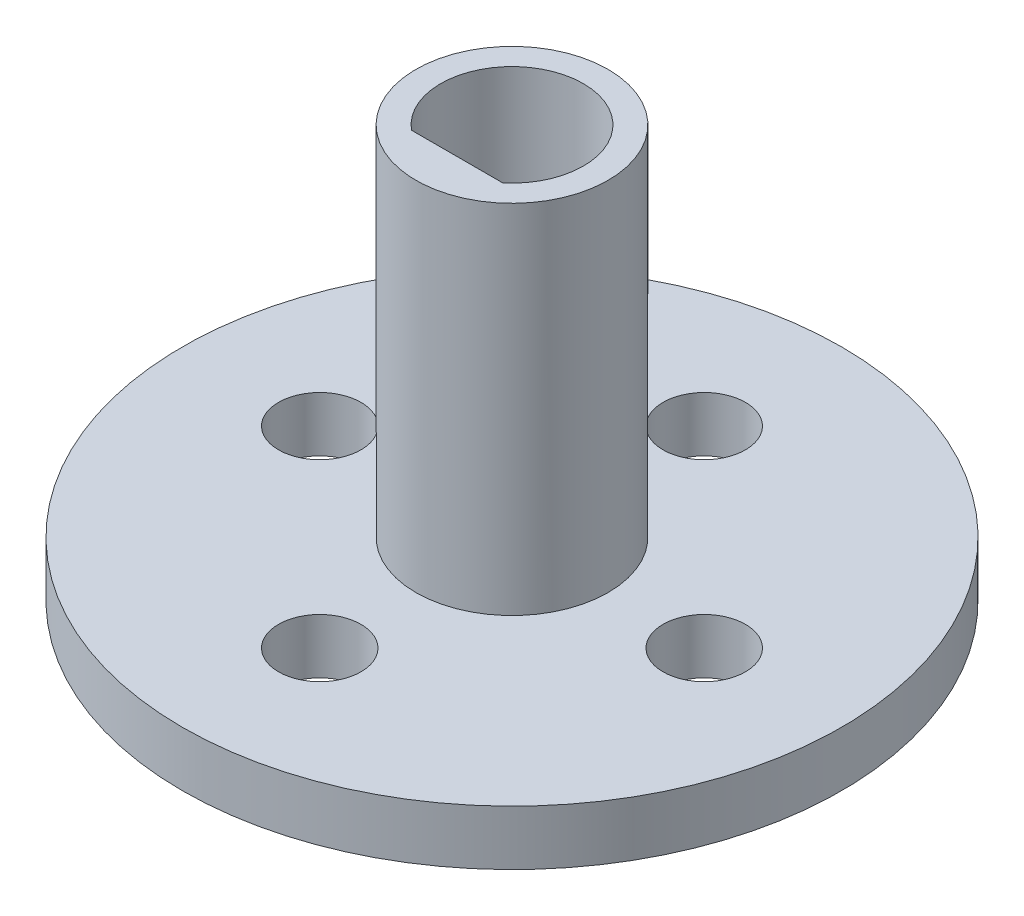
from build123d import *

# Parameters (mm, degrees)
SKETCH_2_R          = 12
SKETCH_2_R_2        = 1.5
EXTRUDE_1_DEPTH     = 2
SKETCH_3_R          = 3.5
EXTRUDE_2_DEPTH     = 15
CUT_EXTRUDE_1_DEPTH = 22.377558326


with BuildPart() as part:
    # 草图2 → 凸台-拉伸1 (new body)
    with BuildSketch(Plane(origin=(0, 0, 0), x_dir=(1, 0, 0), z_dir=(0, 1, 0))):
        with Locations(Location((0, 0, 0), (0, 0, 270))):
            Circle(SKETCH_2_R)
        with Locations(Location((0, 7, 0), (0, 0, 270))):
            Circle(SKETCH_2_R_2, mode=Mode.SUBTRACT)
        with Locations(Location((7, 0, 0), (0, 0, 270))):
            Circle(SKETCH_2_R_2, mode=Mode.SUBTRACT)
        with Locations(Location((0, -7, 0), (0, 0, 270))):
            Circle(SKETCH_2_R_2, mode=Mode.SUBTRACT)
        with Locations(Location((-7, 0, 0), (0, 0, 270))):
            Circle(SKETCH_2_R_2, mode=Mode.SUBTRACT)
    extrude(amount=EXTRUDE_1_DEPTH)

    # 草图3 → 凸台-拉伸2 (add)
    with BuildSketch(Plane.XZ):
        with Locations(Location((0, 0, 0), (0, 0, 270))):
            Circle(SKETCH_3_R)
        with BuildLine():
            Line((-1.661324773, 2), (1.661324773, 2))
            ThreePointArc((1.661324773, 2), (0, -2.6), (-1.661324773, 2))
        make_face(mode=Mode.SUBTRACT)
    extrude(amount=-EXTRUDE_2_DEPTH)

    # 草图4 → 切除-拉伸1 (cut, through all)
    with BuildSketch(Plane(origin=(0, 2, 0), x_dir=(1, 0, 0), z_dir=(0, 1, 0))):
        with BuildLine():
            Line((-1.661324773, -2), (1.661324773, -2))
            ThreePointArc((1.661324773, -2), (0, 2.6), (-1.661324773, -2))
        make_face()
    extrude(amount=-CUT_EXTRUDE_1_DEPTH, mode=Mode.SUBTRACT)


solid = part.part
